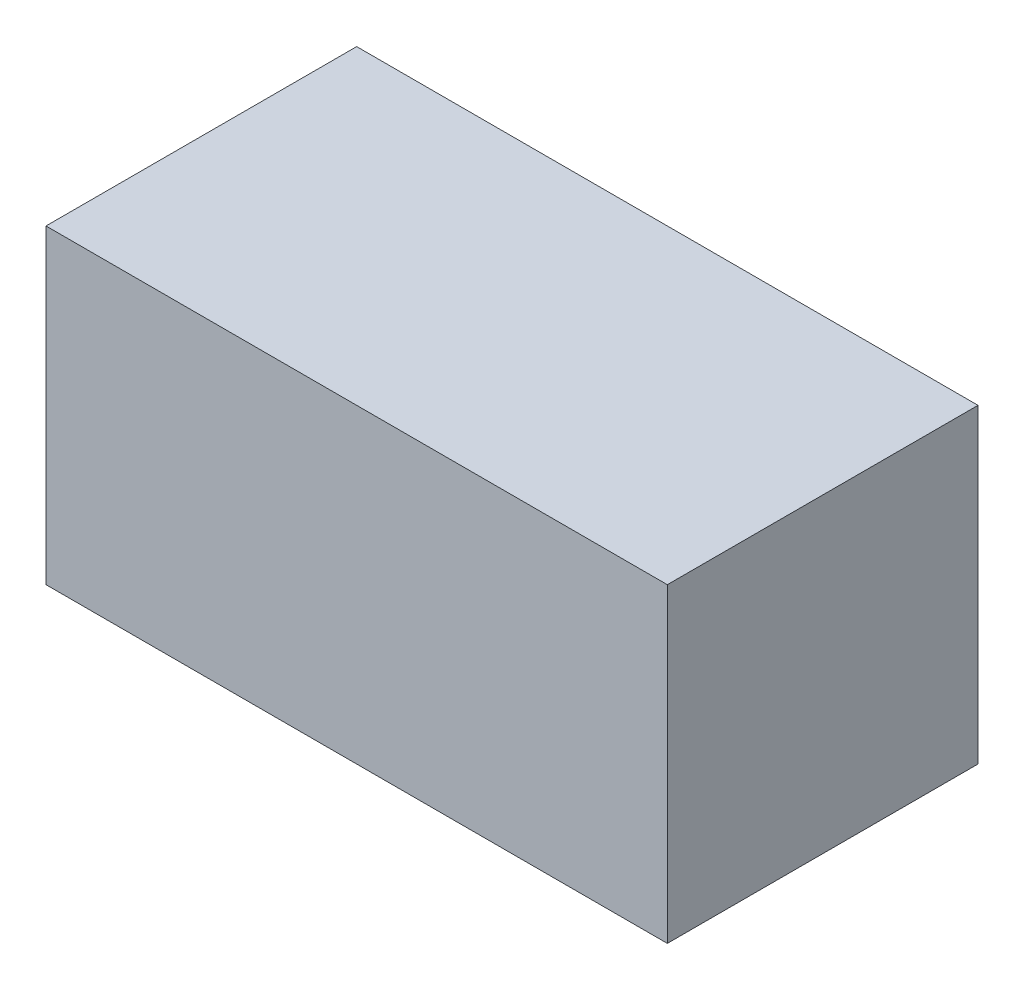
from build123d import *

# Parameters (mm, degrees)
SZKIC1_W                    = 20
SZKIC1_H                    = 10
DODANIE_WYCI_GNI_CIE1_DEPTH = 10


with BuildPart() as part:
    # Szkic1 → Dodanie-wyciągnięcie1 (new body)
    with BuildSketch(Plane.XY):
        Rectangle(SZKIC1_W, SZKIC1_H)
    extrude(amount=DODANIE_WYCI_GNI_CIE1_DEPTH)


solid = part.part
